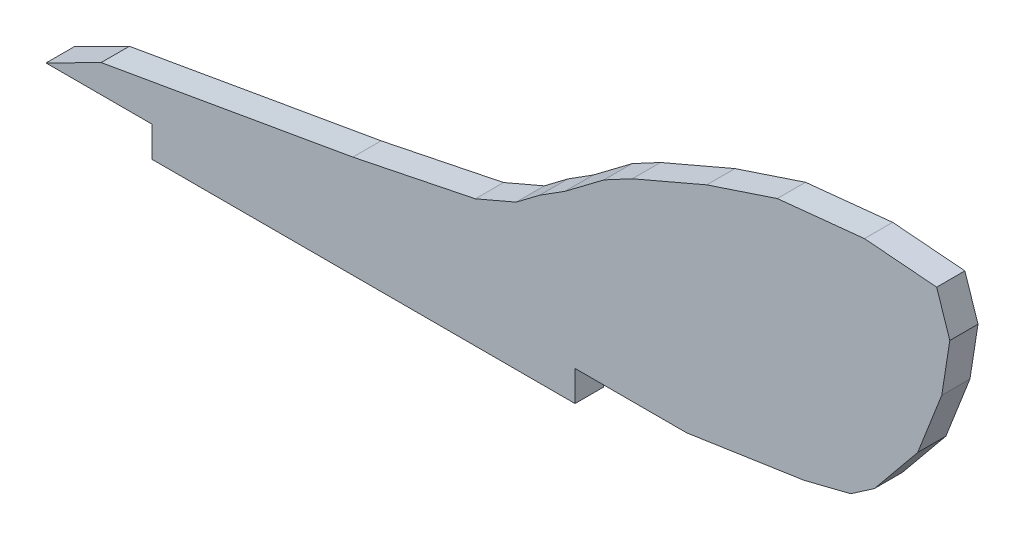
from build123d import *

# Parameters (mm, degrees)
BOSS_EXTRUDE1_DEPTH = 5.08


with BuildPart() as part:
    # Sketch1 → Boss-Extrude1 (new body)
    with BuildSketch(Plane.XY):
        Polygon((0, 0), (9.9314, 5.0292), (55.2704, 12.954), (77.3176, 17.4752), (84.6582, 20.6248), (88.9, 23.8252), (93.472, 26.7208), (100.4824, 32.004), (105.590652808, 34.734537537), (118.999, 40.4876), (131.699, 44.704), (147.3962, 46.3042), (160.400999981, 45.237400002), (162.7632, 38.1), (161.3154, 28.829), (156.972, 17.7292), (149.1742, 8.2042), (144.9324, 5.2832), (136.5504, 3.175), (115.3922, 0), (95.2754, 0), (95.2754, -5.4864), (19.0754, -5.4864), (19.0754, 0), align=None)
    extrude(amount=BOSS_EXTRUDE1_DEPTH)


solid = part.part
